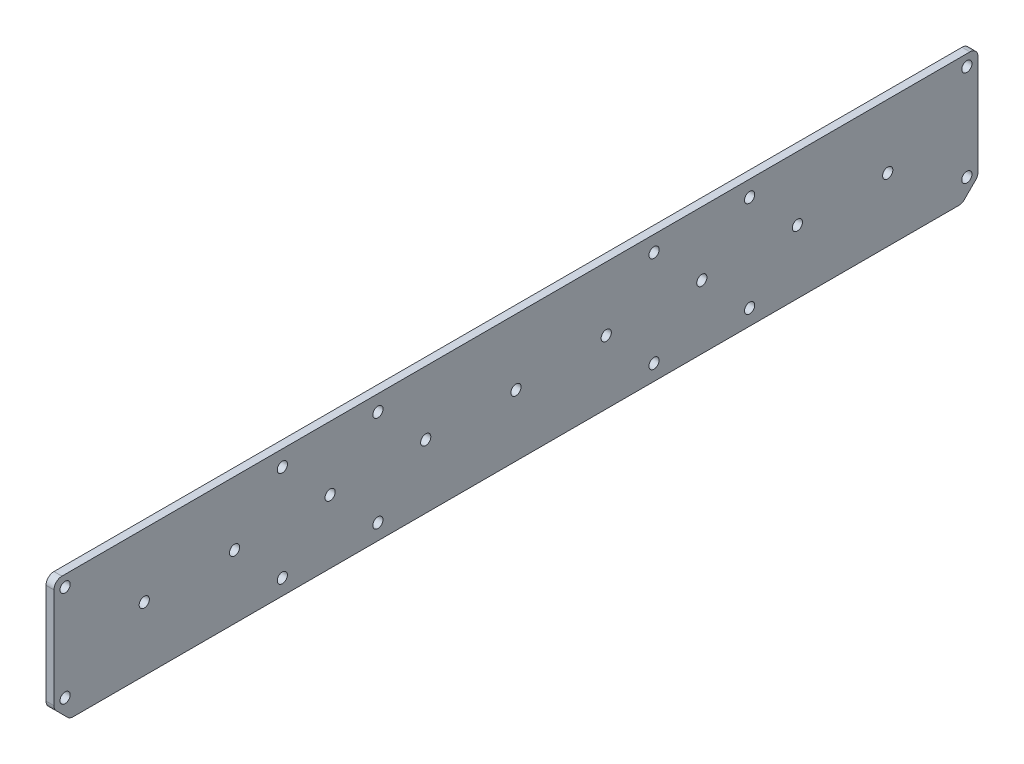
from build123d import *

# Parameters (mm, degrees)
SKETCH1_W                 = 368.3
SKETCH1_H                 = 50.8
BOSS_EXTRUDE1_DEPTH       = 3.175
CHAMFER1_SIZE             = 6.35
FILLET1_R                 = 3.175
F_8_0_16_DIAMETER_HOLE1_D = 4.064


with BuildPart() as part:
    # Sketch1 → Boss-Extrude1 (new body)
    with BuildSketch(Plane(origin=(0, 0, 0), x_dir=(0, 0, -1), z_dir=(1, 0, 0))):
        with Locations((184.15, 25.4)):
            Rectangle(SKETCH1_W, SKETCH1_H)
    extrude(amount=BOSS_EXTRUDE1_DEPTH)

    # Chamfer1
    chamfer1_edges = [part.edges().sort_by_distance(p)[0] for p in [
        (1.5875, 0, -368.3),
        (1.5875, 0, 0),
    ]]
    chamfer(chamfer1_edges, length=CHAMFER1_SIZE)

    # Fillet1
    fillet1_edges = [part.edges().sort_by_distance(p)[0] for p in [
        (1.5875, 6.35, -368.3),
        (1.5875, 0, -6.35),
        (1.5875, 0, -361.95),
        (1.5875, 6.35, 0),
        (1.5875, 50.8, 0),
        (1.5875, 50.8, -368.3),
    ]]
    fillet(fillet1_edges, radius=FILLET1_R)

    # #8 (0.16) Diameter Hole1 (through all)
    with Locations(Plane(origin=(3.175, 0, 0), x_dir=(0, 0, -1), z_dir=(1, 0, 0))):
        with Locations((91.025422327, 6.283968606), (91.025422327, 44.516031394), (71.975422327, 25.4), (35.992088994, 25.4), (148.175422327, 25.4), (129.125422327, 6.283968606), (110.075422327, 25.4), (129.125422327, 44.516031394), (184.15, 24.60625), (220.124577673, 25.4), (239.174577673, 6.283968606), (239.174577673, 44.516031394), (258.224577673, 25.4), (277.274577673, 6.283968606), (277.274577673, 44.516031394), (296.324577673, 25.4), (332.307911006, 25.4), (363.855, 46.355), (4.445, 46.355), (4.445, 8.191179285), (363.855, 8.191179285)):
            Hole(F_8_0_16_DIAMETER_HOLE1_D / 2)


solid = part.part
